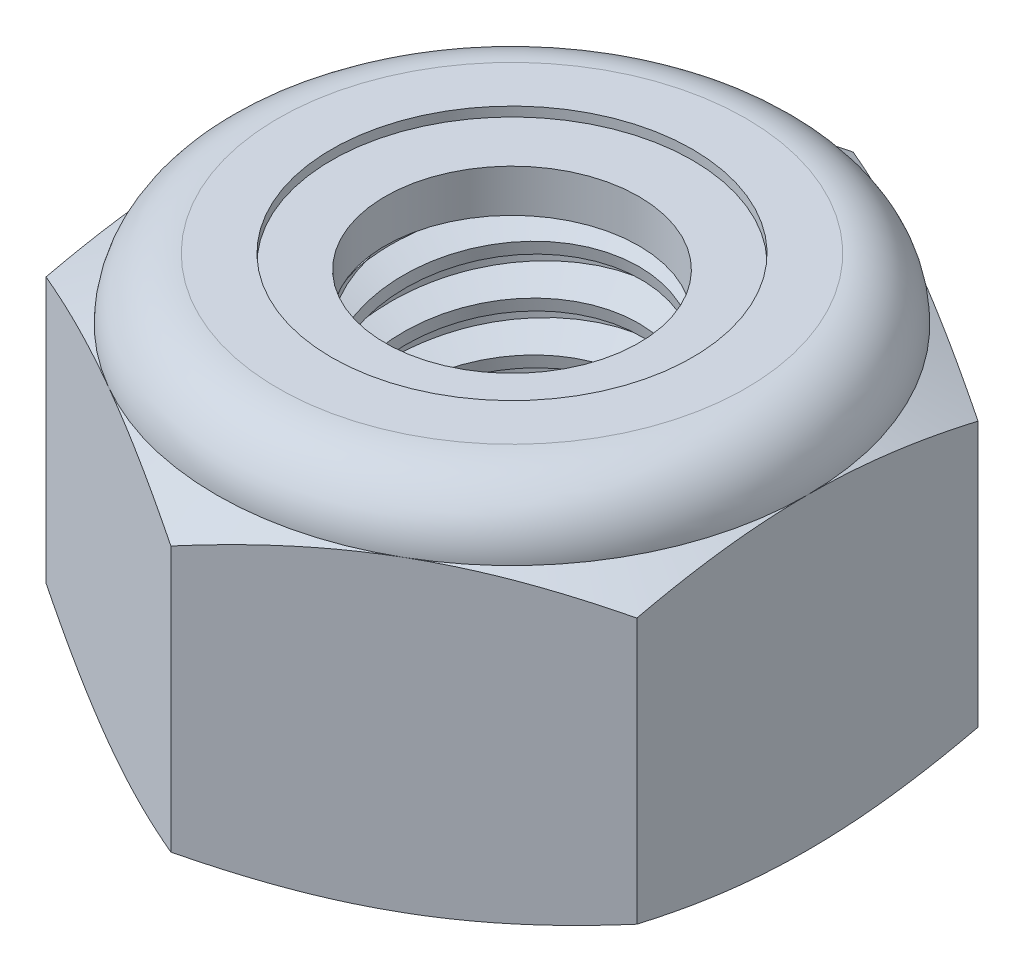
from build123d import *

# Parameters (mm, degrees)
EXTRUDE1_DEPTH      = 5.953125
SKETCH2_W           = 2.413
SKETCH2_H           = 5.953125
LPATTERN1_COUNT     = 8
LPATTERN1_PITCH     = 0.79375
LPATTERN1_COL_COUNT = 2
LPATTERN1_COL_PITCH = 0.79375


with BuildPart() as part:
    # Sketch1 → Extrude1 (new body)
    with BuildSketch(Plane(origin=(0, 0, 0), x_dir=(1, 0, 0), z_dir=(0, 1, 0))):
        Polygon((0, 5.499261314), (-4.7625, 2.749630657), (-4.7625, -2.749630657), (0, -5.499261314), (4.7625, -2.749630657), (4.7625, 2.749630657), align=None)
    extrude(amount=EXTRUDE1_DEPTH)

    # Sketch4 → Cut-Revolve2 (revolve, cut)
    with BuildSketch(Plane(origin=(0, 0, 0), x_dir=(0, 0, -1), z_dir=(1, 0, 0)), mode=Mode.PRIVATE) as cut_revolve2_sk:
        Polygon((0, 5.953125), (2.413, 5.953125), (2.045424837, 5.781721887), (2.045424837, 0.171403113), (2.413, 0), (0, 0), align=None)
    revolve(cut_revolve2_sk.sketch.rotate(Axis((0, 5.953125, 0), (0, 1, 0)), 55.135741266), axis=Axis((0, 5.953125, 0), (0, 1, 0)), mode=Mode.SUBTRACT)


with BuildPart() as body_2:
    # Sketch2 → Revolve1 (revolve)
    with BuildSketch(Plane(origin=(0, 0, 0), x_dir=(0, 0, -1), z_dir=(1, 0, 0))):
        with Locations((1.2065, 2.9765625)):
            Rectangle(SKETCH2_W, SKETCH2_H)
    revolve(axis=Axis((0, -2.413, 0), (0, 1, 0)))

    # Sketch3 → Cut-Revolve1 (revolve, cut)
    with BuildSketch(Plane(origin=(0, 0, 0), x_dir=(0, 0, -1), z_dir=(1, 0, 0)), mode=Mode.PRIVATE) as cut_revolve1_sk:
        Polygon((2.429102527, 5.855221635), (2.541820218, 5.169898076), (2.077629892, 5.344930502), (2.045424837, 5.540737233), align=None)
    cut_revolve1 = revolve(cut_revolve1_sk.sketch.rotate(Axis((0, 5.953125, 0.139697061), (0, -0.9867425810390563, -0.16229318767089815)), 180), axis=Axis((0, 5.953125, 0.139697061), (0, -0.9867425810390563, -0.16229318767089815)), mode=Mode.SUBTRACT)

    # LPattern1: Cut-Revolve1 ×8
    with Locations(*[(0, -i * LPATTERN1_PITCH, 0) for i in range(1, LPATTERN1_COUNT)]):
        add(cut_revolve1, mode=Mode.SUBTRACT)

    # LPattern1 col: Cut-Revolve1 ×2
    with Locations(*[(0, i * LPATTERN1_COL_PITCH, 0) for i in range(1, LPATTERN1_COL_COUNT)]):
        add(cut_revolve1, mode=Mode.SUBTRACT)


with BuildPart() as part_1:
    add(part.part)

    # Combine1: cut body 2
    add(body_2.part, mode=Mode.SUBTRACT)

    # Sketch5 → Cut-Revolve3 (revolve, cut)
    with BuildSketch(Plane(origin=(0, 0, 0), x_dir=(0, 0, -1), z_dir=(1, 0, 0)), mode=Mode.PRIVATE) as cut_revolve3_sk:
        with BuildLine():
            Line((0, 0), (4.7625, 0))
            Line((4.7625, 0), (5.499261314, 0.343557443))
            Line((5.499261314, 0.343557443), (5.499261314, 4.617380057))
            Line((5.499261314, 4.617380057), (4.7625, 4.9609375))
            ThreePointArc((4.7625, 4.9609375), (4.471895009, 5.662520009), (3.7703125, 5.953125))
            Line((3.7703125, 5.953125), (3.7703125, 7.223125))
            Line((3.7703125, 7.223125), (6.769261314, 7.223125))
            Line((6.769261314, 7.223125), (6.769261314, -1.27))
            Line((6.769261314, -1.27), (0, -1.27))
            Line((0, -1.27), (0, 0))
        make_face()
    revolve(cut_revolve3_sk.sketch.rotate(Axis((0, 0, 0), (0, 1, 0)), 55.135741266), axis=Axis((0, 0, 0), (0, 1, 0)), mode=Mode.SUBTRACT)

    # Sketch6 → Cut-Revolve4 (revolve, cut)
    with BuildSketch(Plane(origin=(0, 0, 0), x_dir=(0, 0, -1), z_dir=(1, 0, 0)), mode=Mode.PRIVATE) as cut_revolve4_sk:
        with BuildLine():
            Line((0, 4.9609375), (4.6101, 4.9609375))
            ThreePointArc((4.6101, 4.9609375), (4.364131936, 5.554756936), (3.7703125, 5.800725))
            Line((3.7703125, 5.800725), (2.907868669, 5.800725))
            Line((2.907868669, 5.800725), (2.907868669, 7.223125))
            Line((2.907868669, 7.223125), (0, 7.223125))
            Line((0, 7.223125), (0, 4.9609375))
        make_face()
    revolve(cut_revolve4_sk.sketch.rotate(Axis((0, 7.223125, 0), (0, 1, 0)), 55.135741266), axis=Axis((0, 7.223125, 0), (0, 1, 0)), mode=Mode.SUBTRACT)


with BuildPart() as body_2_2:
    # Sketch7 → Revolve2 (revolve)
    with BuildSketch(Plane(origin=(0, 0, 0), x_dir=(0, 0, -1), z_dir=(1, 0, 0))):
        with BuildLine():
            Line((2.045424837, 5.0371375), (4.530088408, 5.0371375))
            ThreePointArc((4.530088408, 5.0371375), (4.282601726, 5.527175629), (3.7703125, 5.724525))
            Line((3.7703125, 5.724525), (2.045424837, 5.724525))
            Line((2.045424837, 5.724525), (2.045424837, 5.0371375))
        make_face()
    revolve(axis=Axis((0, 5.0371375, 0), (0, 1, 0)))


solid = Compound([part_1.part, body_2_2.part])
